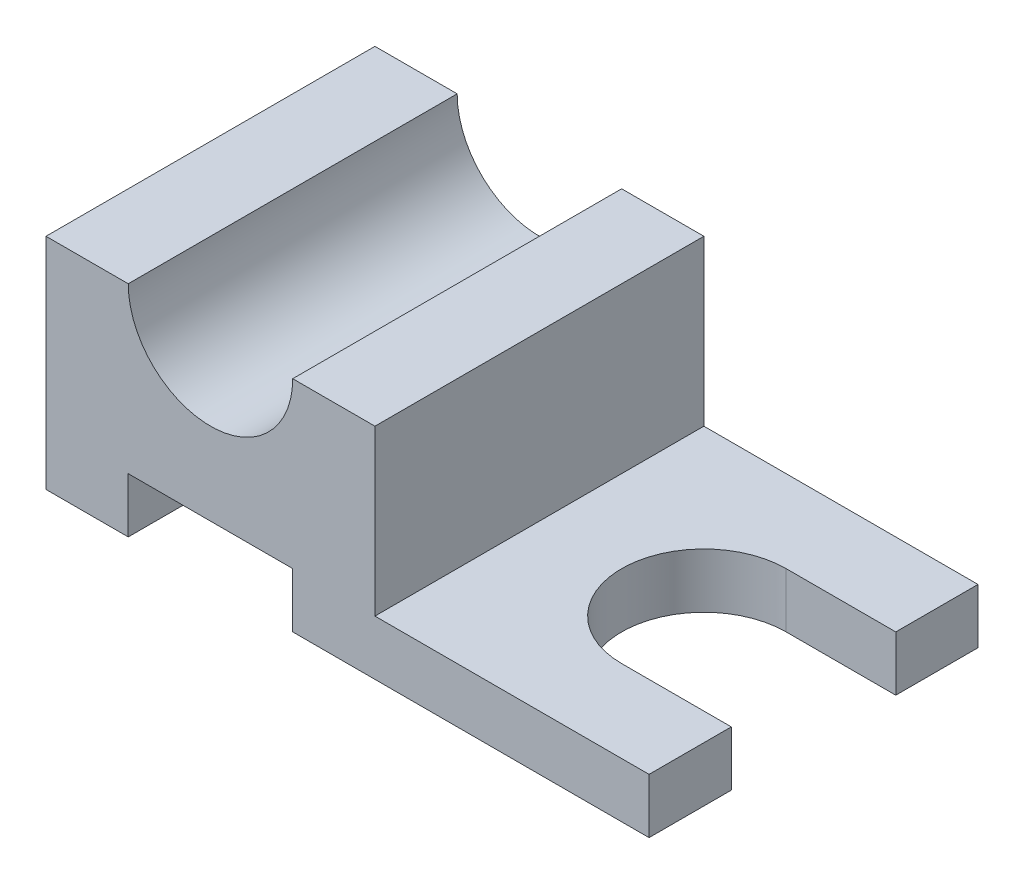
from build123d import *

# Parameters (mm, degrees)
BOSS_EXTRUDE1_DEPTH = 60
CUT_EXTRUDE1_DEPTH  = 60


with BuildPart() as part:
    # Sketch1 → Boss-Extrude1 (new body)
    with BuildSketch(Plane.XY):
        with BuildLine():
            Line((-30, 50.32677643), (-30, 10.32677643))
            Line((-30, 10.32677643), (-15, 10.32677643))
            Line((-15, 10.32677643), (-15, 20.32677643))
            Line((-15, 20.32677643), (15, 20.32677643))
            Line((15, 20.32677643), (15, 10.32677643))
            Line((15, 10.32677643), (80, 10.32677643))
            Line((80, 10.32677643), (80, 20.32677643))
            Line((80, 20.32677643), (30, 20.32677643))
            Line((30, 20.32677643), (30, 50.32677643))
            Line((30, 50.32677643), (15, 50.32677643))
            ThreePointArc((15, 50.32677643), (0, 35.32677643), (-15, 50.32677643))
            Line((-15, 50.32677643), (-30, 50.32677643))
        make_face()
    extrude(amount=BOSS_EXTRUDE1_DEPTH)

    # Sketch2 → Cut-Extrude1 (cut)
    with BuildSketch(Plane(origin=(0, 20.32677643, 0), x_dir=(1, 0, 0), z_dir=(0, 1, 0))):
        with BuildLine():
            Line((80, -15), (80, -45))
            Line((80, -45), (60, -45))
            ThreePointArc((60, -45), (45, -30), (60, -15))
            Line((60, -15), (80, -15))
        make_face()
    extrude(amount=-CUT_EXTRUDE1_DEPTH, mode=Mode.SUBTRACT)


solid = part.part
